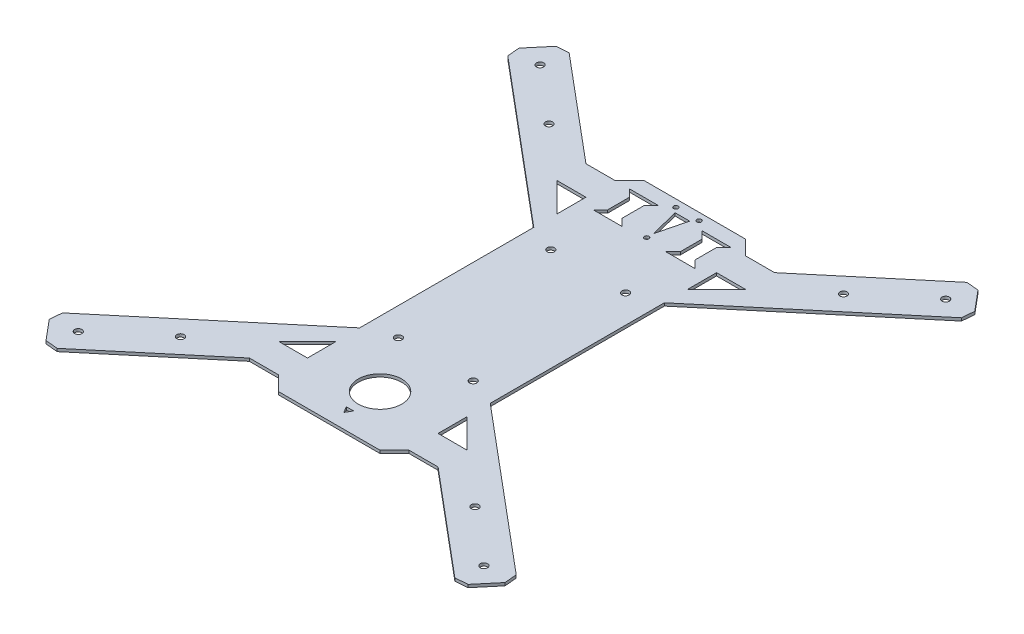
from build123d import *

# Parameters (mm, degrees)
Y_KSEKLIK_EKSTR_ZYON2_DEPTH = 2
KES_EKSTR_ZYON2_DEPTH       = 2
KES_EKSTR_ZYON3_DEPTH       = 20
PAH1_SIZE                   = 6
IZIM6_R                     = 2.5
KES_EKSTR_ZYON4_DEPTH       = 20
IZIM7_R                     = 1.55
KES_EKSTR_ZYON5_DEPTH       = 10
IZIM8_R                     = 15
KES_EKSTR_ZYON6_DEPTH       = 2
KES_EKSTR_ZYON7_DEPTH       = 10
KES_EKSTR_ZYON8_DEPTH       = 10
IZIM11_R                    = 2.5
KES_EKSTR_ZYON9_DEPTH       = 10


with BuildPart() as part:
    # Çizim2 → Yükseklik-Ekstrüzyon2 (new body)
    with BuildSketch(Plane(origin=(0, 0, 0), x_dir=(1, 0, 0), z_dir=(0, 1, 0))):
        Polygon((-160.888072602, 157.241638979), (-45, 60), (-45, -60), (-160.888072602, -157.241638979), (-141.604444312, -180.222972272), (-65, -115.944211304), (-45, -115.944211304), (-35, -125.944211304), (35, -125.944211304), (45, -115.944211304), (65, -115.944211304), (141.604444312, -180.222972272), (160.888072602, -157.241638979), (45, -60), (45, 60), (160.888072602, 157.241638979), (141.604444312, 180.222972272), (65, 115.944211304), (45, 115.944211304), (35, 125.944211304), (-35, 125.944211304), (-45, 115.944211304), (-65, 115.944211304), (-141.604444312, 180.222972272), align=None)
    extrude(amount=Y_KSEKLIK_EKSTR_ZYON2_DEPTH)

    # Çizim4 → Kes-Ekstrüzyon2 (cut)
    with BuildSketch(Plane(origin=(0, 2, 0), x_dir=(1, 0, 0), z_dir=(0, 1, 0))):
        Polygon((-2.5, -111.614084285), (0, -115.944211304), (2.5, -111.614084285), align=None)
    extrude(amount=-KES_EKSTR_ZYON2_DEPTH, mode=Mode.SUBTRACT)

    # Çizim5 → Kes-Ekstrüzyon3 (cut)
    with BuildSketch(Plane(origin=(0, 2, 0), x_dir=(1, 0, 0), z_dir=(0, 1, 0))):
        Polygon((-65, 95.944211304), (-45, 95.944211304), (-45, 75.944211304), align=None)
        Polygon((45, 75.944211304), (65, 95.944211304), (45, 95.944211304), align=None)
        Polygon((65, -95.944211304), (45, -95.944211304), (45, -75.944211304), align=None)
        Polygon((-45, -75.944211304), (-65, -95.944211304), (-45, -95.944211304), align=None)
    extrude(amount=-KES_EKSTR_ZYON3_DEPTH, mode=Mode.SUBTRACT)

    # Pah1
    pah1_edges = [part.edges().sort_by_distance(p)[0] for p in [
        (-160.888072602, 1, -157.241638979),
        (-141.604444312, 1, -180.222972272),
        (141.604444312, 1, -180.222972272),
        (160.888072602, 1, -157.241638979),
        (160.888072602, 1, 157.241638979),
        (141.604444312, 1, 180.222972272),
        (-141.604444312, 1, 180.222972272),
        (-160.888072602, 1, 157.241638979),
    ]]
    chamfer(pah1_edges, length=PAH1_SIZE)

    # Çizim6 → Kes-Ekstrüzyon4 (cut)
    with BuildSketch(Plane(origin=(0, 2, 0), x_dir=(1, 0, 0), z_dir=(0, 1, 0))):
        with Locations(Location((-139.75559181, 159.09049148, 0), (0, 0, 270))):
            Circle(IZIM6_R)
        with Locations(Location((-101.453369654, 126.951110996, 0), (0, 0, 270))):
            Circle(IZIM6_R)
        with Locations(Location((101.453369654, 126.951110996, 0), (0, 0, 270))):
            Circle(IZIM6_R)
        with Locations(Location((139.75559181, 159.09049148, 0), (0, 0, 270))):
            Circle(IZIM6_R)
        with Locations(Location((101.453369654, -126.951110996, 0), (0, 0, 270))):
            Circle(IZIM6_R)
        with Locations(Location((139.75559181, -159.09049148, 0), (0, 0, 270))):
            Circle(IZIM6_R)
        with Locations(Location((-101.453369654, -126.951110996, 0), (0, 0, 270))):
            Circle(IZIM6_R)
        with Locations(Location((-139.75559181, -159.09049148, 0), (0, 0, 270))):
            Circle(IZIM6_R)
    extrude(amount=-KES_EKSTR_ZYON4_DEPTH, mode=Mode.SUBTRACT)

    # Çizim7 → Kes-Ekstrüzyon5 (cut)
    with BuildSketch(Plane(origin=(0, 2, 0), x_dir=(1, 0, 0), z_dir=(0, 1, 0))):
        with Locations(Location((-8, 120.944211304, 0), (0, 0, 270))):
            Circle(IZIM7_R)
        with Locations(Location((8, 120.944211304, 0), (0, 0, 270))):
            Circle(IZIM7_R)
        with Locations(Location((0, 92.780546714, 0), (0, 0, 270))):
            Circle(IZIM7_R)
    extrude(amount=-KES_EKSTR_ZYON5_DEPTH, mode=Mode.SUBTRACT)

    # Çizim8 → Kes-Ekstrüzyon6 (cut)
    with BuildSketch(Plane(origin=(0, 2, 0), x_dir=(1, 0, 0), z_dir=(0, 1, 0))):
        with Locations(Location((0, -90.944211304, 0), (0, 0, 270))):
            Circle(IZIM8_R)
    extrude(amount=-KES_EKSTR_ZYON6_DEPTH, mode=Mode.SUBTRACT)

    # Çizim9 → Kes-Ekstrüzyon7 (cut)
    with BuildSketch(Plane(origin=(0, 2, 0), x_dir=(1, 0, 0), z_dir=(0, 1, 0))):
        Polygon((-35, 115.944211304), (-15, 115.944211304), (-20, 110.944211304), (-20, 95.944211304), (-15, 90.944211304), (-35, 90.944211304), (-30, 95.944211304), (-30, 110.944211304), align=None)
        Polygon((30, 110.944211304), (35, 115.944211304), (15, 115.944211304), (20, 110.944211304), (20, 95.944211304), (15, 90.944211304), (35, 90.944211304), (30, 95.944211304), align=None)
    extrude(amount=-KES_EKSTR_ZYON7_DEPTH, mode=Mode.SUBTRACT)

    # Çizim10 → Kes-Ekstrüzyon8 (cut)
    with BuildSketch(Plane(origin=(0, 2, 0), x_dir=(1, 0, 0), z_dir=(0, 1, 0))):
        Polygon((-5, 117.413602047), (0, 97.413602047), (5, 117.413602047), align=None)
    extrude(amount=-KES_EKSTR_ZYON8_DEPTH, mode=Mode.SUBTRACT)

    # Çizim11 → Kes-Ekstrüzyon9 (cut)
    with BuildSketch(Plane(origin=(0, 2, 0), x_dir=(1, 0, 0), z_dir=(0, 1, 0))):
        with Locations(Location((25.75, -52.5, 0), (0, 0, 270))):
            Circle(IZIM11_R)
        with Locations(Location((-25.75, -52.5, 0), (0, 0, 270))):
            Circle(IZIM11_R)
        with Locations(Location((-25.75, 52.5, 0), (0, 0, 270))):
            Circle(IZIM11_R)
        with Locations(Location((25.75, 52.5, 0), (0, 0, 270))):
            Circle(IZIM11_R)
    extrude(amount=-KES_EKSTR_ZYON9_DEPTH, mode=Mode.SUBTRACT)


solid = part.part
